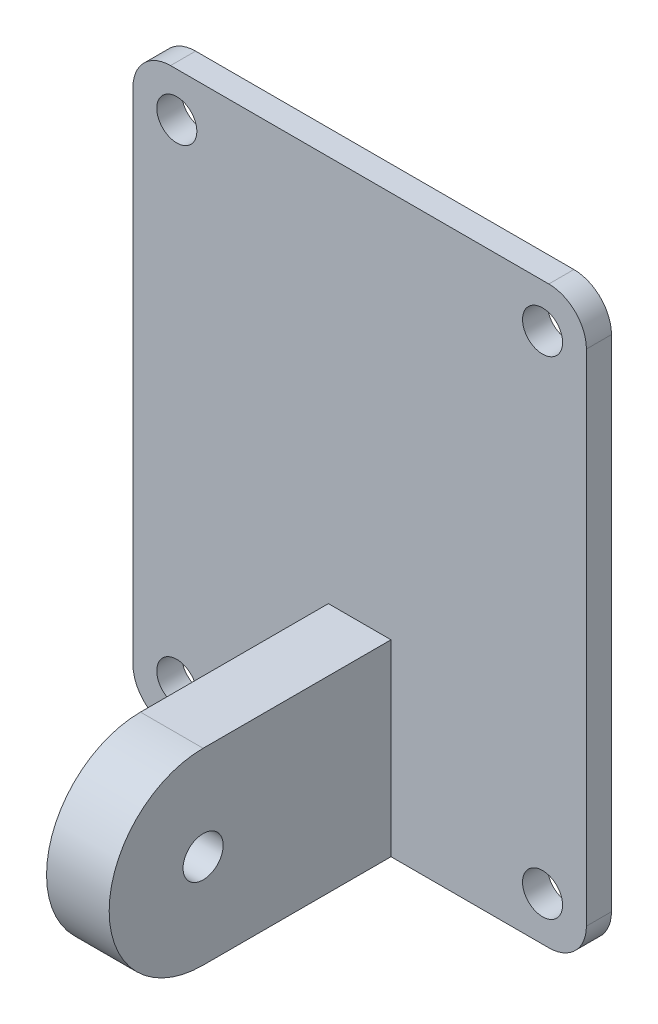
from build123d import *

# Parameters (mm, degrees)
MODEL_R             = 1.6
EXTRUDE_1_DEPTH     = 2
SKETCH_2_W          = 5
SKETCH_2_H          = 15
EXTRUDE_2_DEPTH     = 15
EXTRUDE_3_DEPTH     = 5
SKETCH_4_R          = 1.6
CUT_EXTRUDE_1_DEPTH = 5


with BuildPart() as part:
    # Model → 凸台-拉伸1 (new body)
    with BuildSketch(Plane.XY):
        with BuildLine():
            Line((312.88241623, 324.041107056), (343.08241623, 324.041107056))
            ThreePointArc((343.08241623, 324.041107056), (345.203736573, 323.1624274), (346.08241623, 321.041107056))
            Line((346.08241623, 321.041107056), (346.08241623, 281.141107056))
            ThreePointArc((346.08241623, 281.141107056), (345.203736573, 279.019786713), (343.08241623, 278.141107056))
            Line((343.08241623, 278.141107056), (312.88241623, 278.141107056))
            ThreePointArc((312.88241623, 278.141107056), (310.761095886, 279.019786713), (309.88241623, 281.141107056))
            Line((309.88241623, 281.141107056), (309.88241623, 321.041107056))
            ThreePointArc((309.88241623, 321.041107056), (310.761095886, 323.1624274), (312.88241623, 324.041107056))
        make_face()
        with Locations((313.38241623, 320.541107056)):
            Circle(MODEL_R, mode=Mode.SUBTRACT)
        with Locations((313.38241623, 281.641107056)):
            Circle(MODEL_R, mode=Mode.SUBTRACT)
        with Locations((342.58241623, 320.541107056)):
            Circle(MODEL_R, mode=Mode.SUBTRACT)
        with Locations((342.58241623, 281.641107056)):
            Circle(MODEL_R, mode=Mode.SUBTRACT)
    extrude(amount=EXTRUDE_1_DEPTH)

    # 草图2 → 凸台-拉伸2 (add)
    with BuildSketch(Plane.XY.offset(2)):
        with Locations((327.98241623, 285.641107056)):
            Rectangle(SKETCH_2_W, SKETCH_2_H)
    extrude(amount=EXTRUDE_2_DEPTH)

    # 草图3 → 凸台-拉伸3 (add)
    with BuildSketch(Plane.ZY.offset(-325.48241623)):
        with BuildLine():
            Line((17, 293.141107056), (17, 278.141107056))
            ThreePointArc((17, 278.141107056), (24.5, 285.641107056), (17, 293.141107056))
        make_face()
    extrude(amount=-EXTRUDE_3_DEPTH)

    # 草图4 → 切除-拉伸1 (cut)
    with BuildSketch(Plane.ZY.offset(-325.48241623)):
        with Locations((17, 285.641107056)):
            Circle(SKETCH_4_R)
    extrude(amount=-CUT_EXTRUDE_1_DEPTH, mode=Mode.SUBTRACT)


solid = part.part
